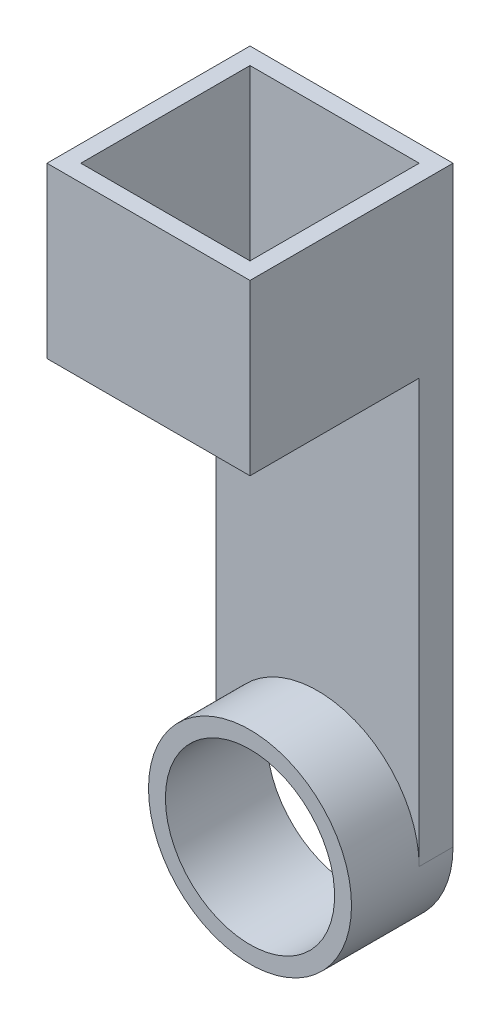
from build123d import *

# Parameters (mm, degrees)
EXTRUDE_1_DEPTH     = 2
SKETCH_4_R          = 6
SKETCH_4_R_2        = 5
EXTRUDE_2_DEPTH     = 6
SKETCH_5_W          = 12
SKETCH_5_H          = 12
EXTRUDE_3_DEPTH     = 10
CUT_EXTRUDE_1_DEPTH = 10


with BuildPart() as part:
    # 草图1 → 凸台-拉伸1 (new body)
    with BuildSketch(Plane.XY):
        with BuildLine():
            ThreePointArc((-6, 0), (0, 6), (6, 0))
            Line((6, 0), (6, 25))
            Line((6, 25), (-6, 25))
            Line((-6, 25), (-6, 0))
        make_face()
    extrude(amount=EXTRUDE_1_DEPTH)

    # 草图4 → 凸台-拉伸2 (add)
    with BuildSketch(Plane(origin=(0, 0, 0), x_dir=(-1, 0, 0), z_dir=(0, 0, -1))):
        Circle(SKETCH_4_R)
        Circle(SKETCH_4_R_2, mode=Mode.SUBTRACT)
    extrude(amount=-EXTRUDE_2_DEPTH)

    # 草图5 → 凸台-拉伸3 (add)
    with BuildSketch(Plane(origin=(0, 25, 0), x_dir=(1, 0, 0), z_dir=(0, 1, 0))):
        with Locations((0, -6)):
            Rectangle(SKETCH_5_W, SKETCH_5_H)
    extrude(amount=EXTRUDE_3_DEPTH)

    # 草图6 → 切除-拉伸1 (cut)
    with BuildSketch(Plane(origin=(0, 35, 0), x_dir=(1, 0, 0), z_dir=(0, 1, 0))):
        Polygon((5, -1), (-5, -1), (5, -11), align=None)
        Polygon((5, -11), (-5, -1), (-5, -11), align=None)
    extrude(amount=-CUT_EXTRUDE_1_DEPTH, mode=Mode.SUBTRACT)


solid = part.part
